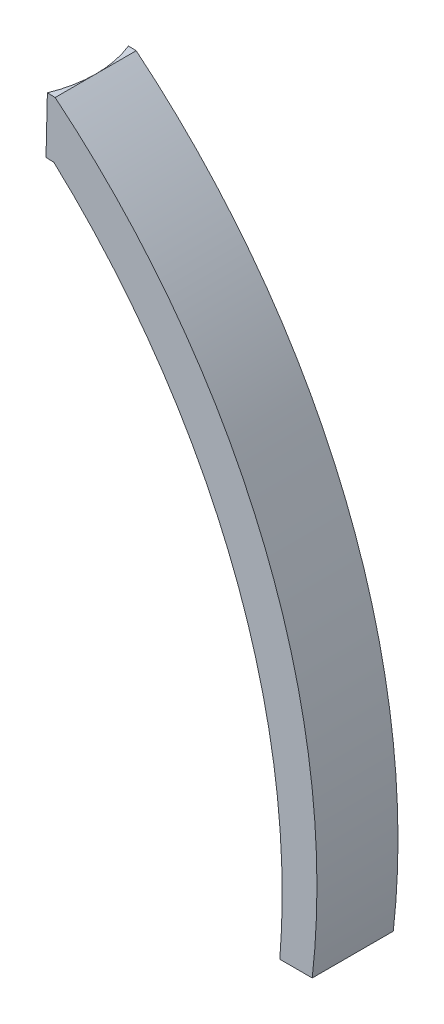
from build123d import *

# Parameters (mm, degrees)
BOSS_EXTRUDE1_DEPTH = 10
BOSS_EXTRUDE2_DEPTH = 7


with BuildPart() as part:
    # Sketch1 → Boss-Extrude1 (new body)
    with BuildSketch(Plane.XY):
        with BuildLine():
            Line((-18.757439303, 33.418117649), (-18.925359206, 26.418117649))
            ThreePointArc((-18.925359206, 26.418117649), (3.268987797, -5.966966431), (8.965935836, -44.811882351))
            Line((8.965935836, -44.811882351), (12.965935836, -44.811882351))
            ThreePointArc((12.965935836, -44.811882351), (7.097147968, -1.644619716), (-18.757439303, 33.418117649))
        make_face()
    extrude(amount=BOSS_EXTRUDE1_DEPTH)

    # Sketch2 → Boss-Extrude2 (add)
    with BuildSketch(Plane(origin=(0.790403617, 32.949193093, 0), x_dir=(0, 0, -1), z_dir=(0.02398165846895122, 0.9997123986712771, 0))):
        with BuildLine():
            Line((-10, 20.513530318), (-10, 19.553466522))
            Line((-10, 19.553466522), (-5, 19.553466522))
            ThreePointArc((-5, 19.553466522), (-7.545668993, 19.795654886), (-10, 20.513530318))
        make_face()
        with BuildLine():
            ThreePointArc((0, 20.513530318), (-2.454331007, 19.795654886), (-5, 19.553466522))
            Line((-5, 19.553466522), (0, 19.553466522))
            Line((0, 19.553466522), (0, 20.513530318))
        make_face()
    extrude(amount=-BOSS_EXTRUDE2_DEPTH)


solid = part.part
